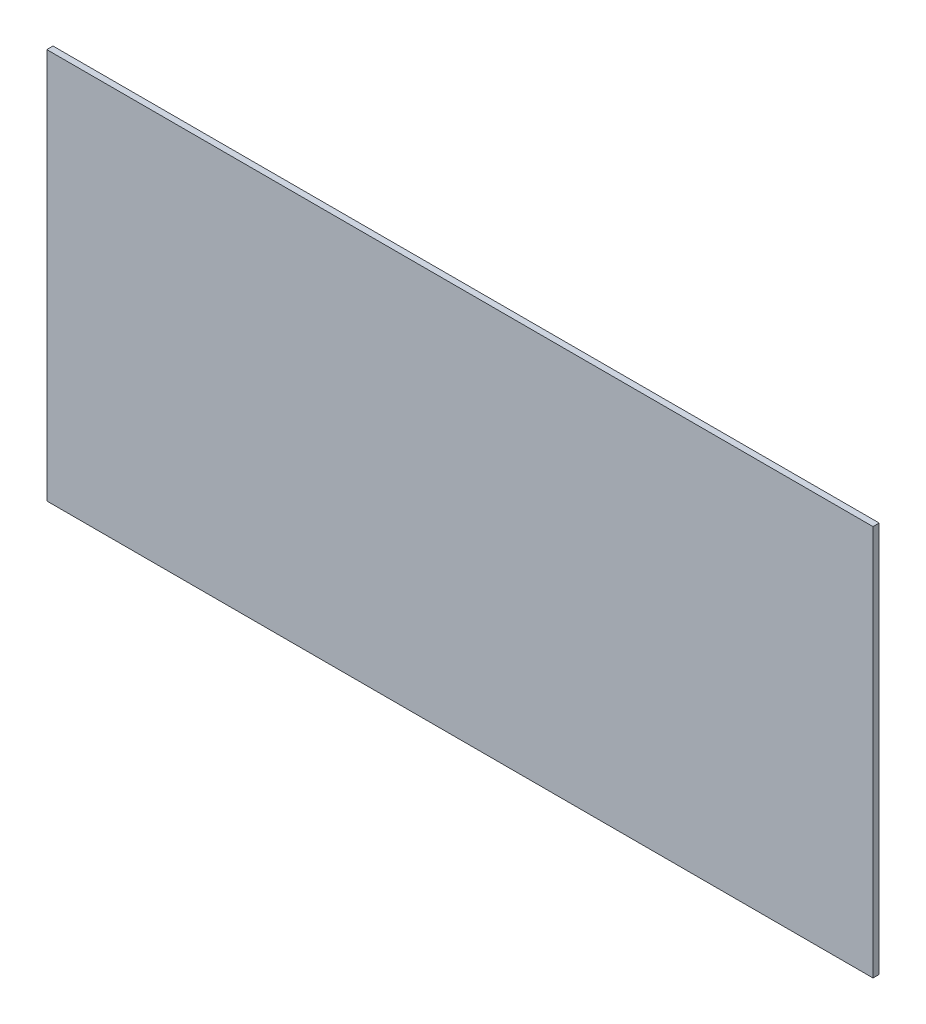
from build123d import *

# Parameters (mm, degrees)
SKETCH1_W           = 422.7
SKETCH1_H           = 200
BOSS_EXTRUDE2_DEPTH = 3.175


with BuildPart() as part:
    # Sketch1 → Boss-Extrude2 (new body)
    with BuildSketch(Plane.XY):
        Rectangle(SKETCH1_W, SKETCH1_H)
    extrude(amount=BOSS_EXTRUDE2_DEPTH)


solid = part.part
